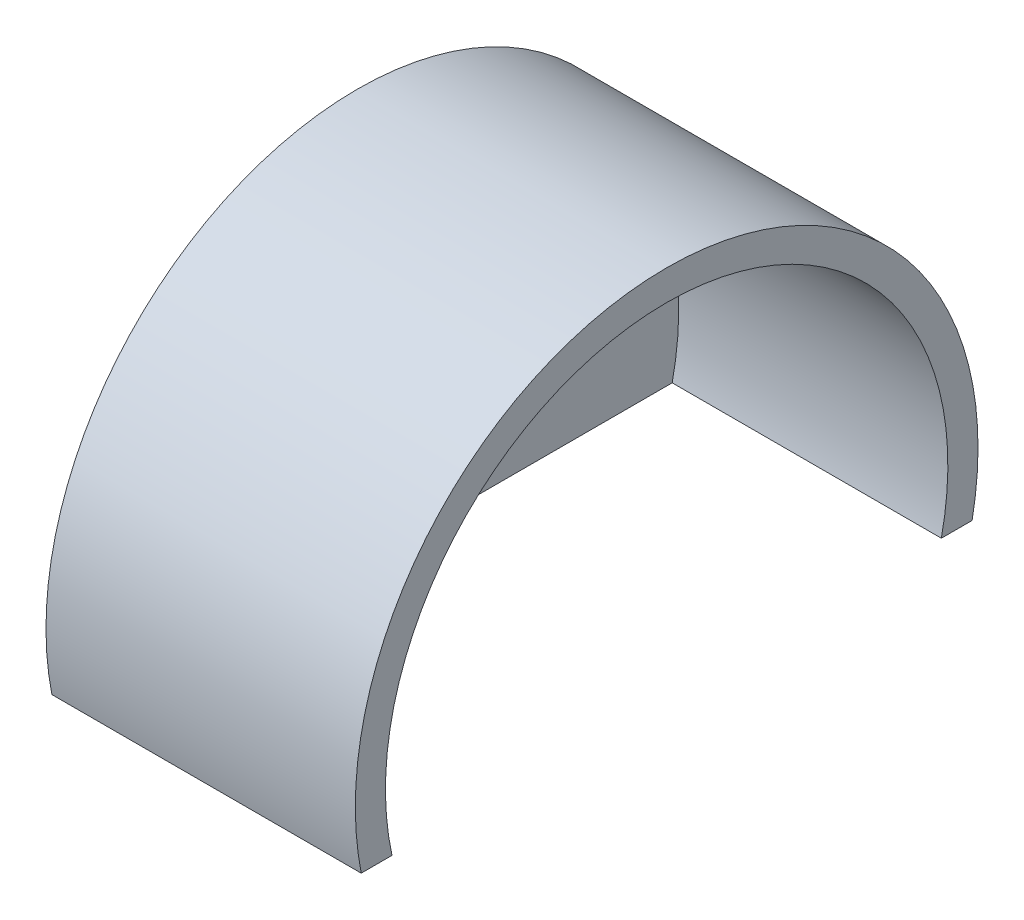
from build123d import *

# Parameters (mm, degrees)
EXTRUDE_1_DEPTH = 4
EXTRUDE_2_DEPTH = 26.8


with BuildPart() as part:
    # 草图1 → 凸台-拉伸1 (new body)
    with BuildSketch(Plane(origin=(0, 0, 0), x_dir=(0, 0, -1), z_dir=(1, 0, 0))):
        with BuildLine():
            Line((-30.413812651, -6), (30.413812651, -6))
            ThreePointArc((30.413812651, -6), (0, 31), (-30.413812651, -6))
        make_face()
    extrude(amount=EXTRUDE_1_DEPTH)

    # 草图2 → 凸台-拉伸2 (add)
    with BuildSketch(Plane(origin=(4, 0, 0), x_dir=(0, 0, -1), z_dir=(1, 0, 0))):
        with BuildLine():
            Line((-30.413812651, -6), (-27.349588662, -6))
            ThreePointArc((-27.349588662, -6), (0, 28), (27.349588662, -6))
            Line((27.349588662, -6), (30.413812651, -6))
            ThreePointArc((30.413812651, -6), (0, 31), (-30.413812651, -6))
        make_face()
    extrude(amount=EXTRUDE_2_DEPTH)


solid = part.part
